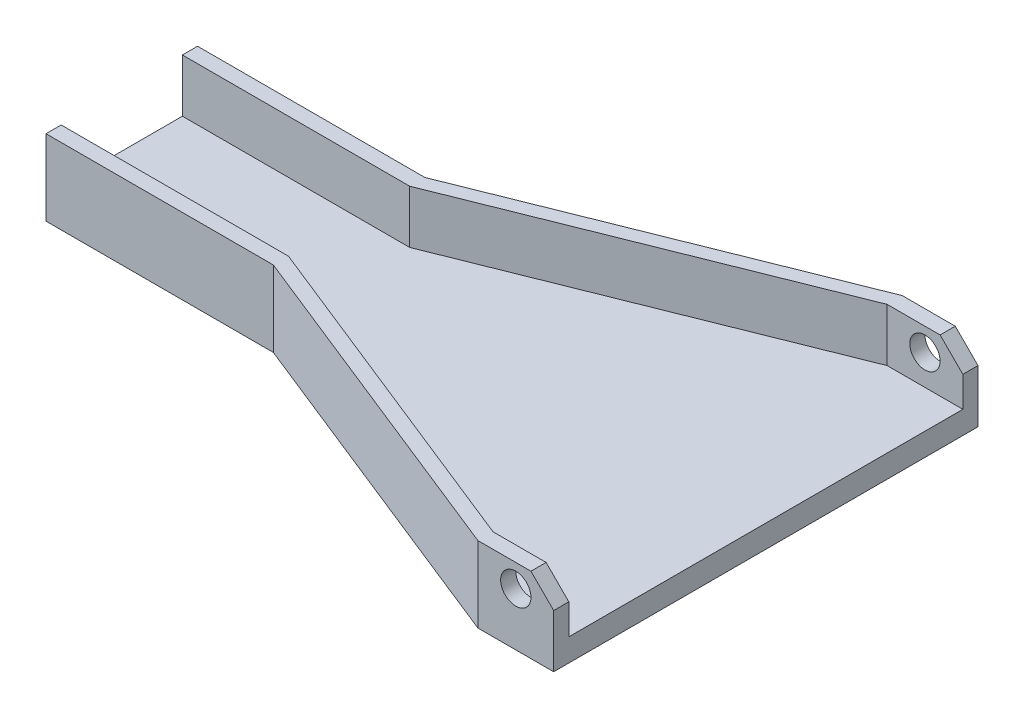
from build123d import *

# Parameters (mm, degrees)
SALIENTE_EXTRUIR1_DEPTH = 3
SALIENTE_EXTRUIR2_DEPTH = 7
CROQUIS3_R              = 2
CORTAR_EXTRUIR1_DEPTH   = 91.19977827
CHAFL_N1_SIZE           = 3


with BuildPart() as part:
    # Croquis1 → Saliente-Extruir1 (new body)
    with BuildSketch(Plane(origin=(0, 0, 0), x_dir=(1, 0, 0), z_dir=(0, 1, 0))):
        Polygon((-15, -10), (15, -10), (60, -28), (70, -28), (70, 28), (60, 28), (15, 10), (-15, 10), align=None)
    extrude(amount=SALIENTE_EXTRUIR1_DEPTH)

    # Croquis2 → Saliente-Extruir2 (add)
    with BuildSketch(Plane(origin=(0, 3, 0), x_dir=(1, 0, 0), z_dir=(0, 1, 0))):
        Polygon((-15, 10), (15, 10), (60, 28), (70, 28), (70, 26), (60, 26), (15, 8), (-15, 8), align=None)
        Polygon((-15, -10), (15, -10), (60, -28), (70, -28), (70, -26), (60, -26), (15, -8), (-15, -8), align=None)
    extrude(amount=SALIENTE_EXTRUIR2_DEPTH)

    # Croquis3 → Cortar-Extruir1 (cut, through all)
    with BuildSketch(Plane.XY.offset(28)):
        with Locations((65, 7)):
            Circle(CROQUIS3_R)
    extrude(amount=-CORTAR_EXTRUIR1_DEPTH, mode=Mode.SUBTRACT)

    # Chaflán1
    chafl_n1_edges = [part.edges().sort_by_distance(p)[0] for p in [
        (70, 10, -27),
        (70, 10, 27),
    ]]
    chamfer(chafl_n1_edges, length=CHAFL_N1_SIZE)


solid = part.part
